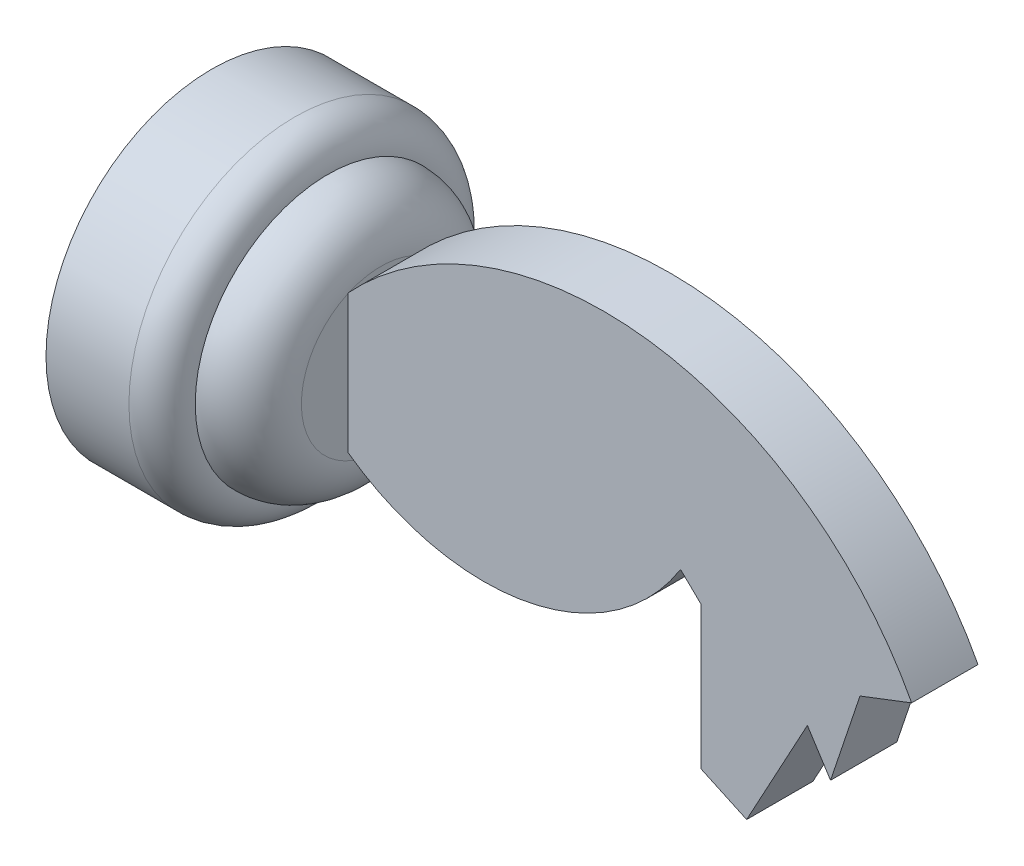
from build123d import *

# Parameters (mm, degrees)
EXTRUDE_2338_DEPTH = 2


with BuildPart() as part:
    # Sketch 227 → Повернуть1 (revolve)
    with BuildSketch(Plane.XY, mode=Mode.PRIVATE) as revolve_1_sk:
        with BuildLine():
            Line((6, 10), (1, 10))
            Line((1, 10), (1, 0))
            Line((1, 0), (2, 0))
            Line((2, 0), (2, 5.25))
            Line((2, 5.25), (4.5, 5.25))
            Line((4.5, 5.25), (4.5, 0))
            Line((4.5, 0), (11.2, 0))
            Line((11.2, 0), (11.2, 4.8))
            ThreePointArc((11.2, 4.8), (10.2627417, 7.0627417), (8, 8))
            ThreePointArc((8, 8), (7.414213562, 9.414213562), (6, 10))
        make_face()
    revolve(revolve_1_sk.sketch.rotate(Axis((0, 0, 0), (1, 0, 0)), 90), axis=Axis((0, 0, 0), (1, 0, 0)))

    # Sketch 1321 → Extrude 2338 (add, symmetric)
    with BuildSketch(Plane.XY):
        with BuildLine():
            ThreePointArc((11.2, 4.4), (29.338267199, 10.995701086), (45.2, 0))
            Line((45.2, 0), (11.2, 0))
            Line((11.2, 0), (11.2, 4.4))
        make_face()
        with BuildLine():
            Line((31.263463773, 0), (11.2, 0))
            Line((11.2, 0), (11.2, -3.914978255))
            ThreePointArc((11.2, -3.914978255), (22.080678837, -6.30816882), (31.263463773, 0))
        make_face()
        Polygon((38.912013935, 0), (35.248695767, 0), (35.248695767, -11.07), (38.912013935, -4.32), align=None)
        Polygon((35.248695767, 0), (31.263463773, 0), (32.498964702, -1.197255299), (32.498964702, -9.797255299), (35.248695767, -11.07), align=None)
        Polygon((42.083014277, -1.2), (42.083014277, 0), (40.307542508, 0), (40.307542508, -6.49), align=None)
        Polygon((40.307542508, 0), (38.912013935, 0), (38.912013935, -4.32), (40.307542508, -6.49), align=None)
        Polygon((42.083014277, -1.2), (45.2, 0), (42.083014277, 0), align=None)
    extrude(amount=EXTRUDE_2338_DEPTH, both=True)


solid = part.part
